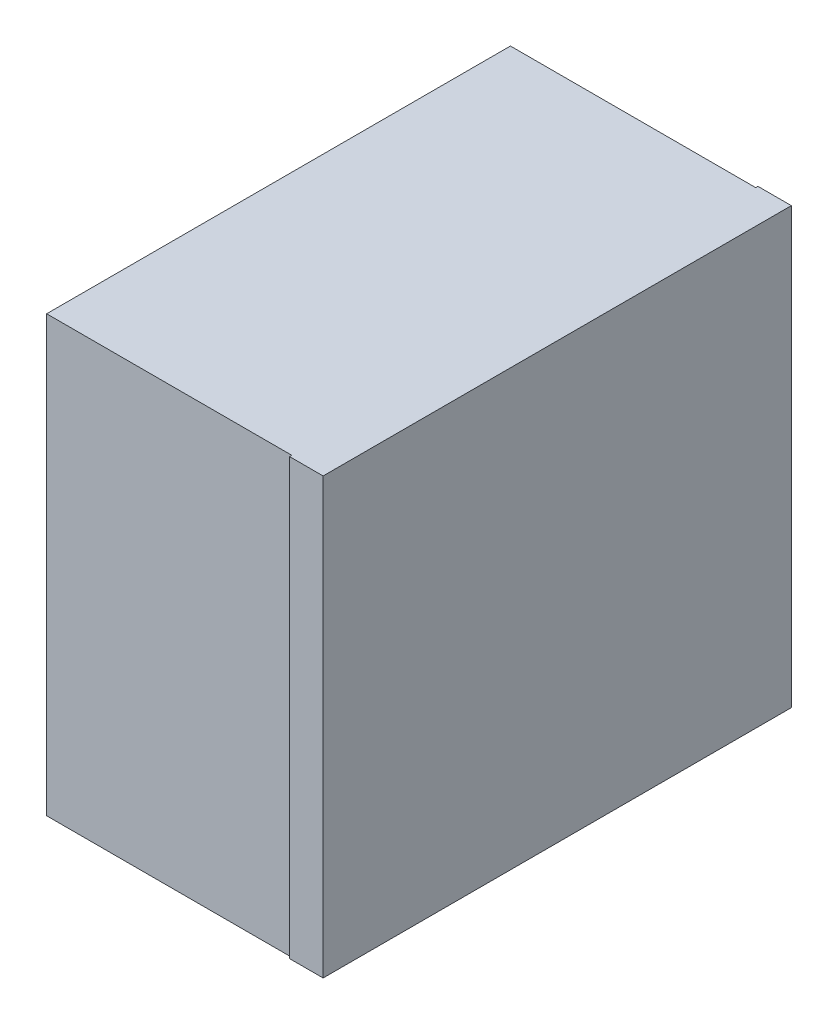
from build123d import *

# Parameters (mm, degrees)
CROQUIS2_W              = 85
CROQUIS2_H              = 85
SALIENTE_EXTRUIR1_DEPTH = 110
CROQUIS3_W              = 20
CROQUIS3_H              = 85
CROQUIS3_W_2            = 7
CORTAR_EXTRUIR1_DEPTH   = 2
CROQUIS5_W              = 83
CROQUIS5_H              = 20
CROQUIS5_H_2            = 7
CORTAR_EXTRUIR2_DEPTH   = 2
CROQUIS6_W              = 20
CROQUIS6_H              = 83
CROQUIS6_W_2            = 7
CORTAR_EXTRUIR3_DEPTH   = 2
CROQUIS7_W              = 81
CROQUIS7_H              = 20
CROQUIS7_H_2            = 7
CORTAR_EXTRUIR4_DEPTH   = 2
CORTAR_EXTRUIR6_DEPTH   = 2
CROQUIS12_W             = 9
CROQUIS12_H             = 9
CORTAR_EXTRUIR7_DEPTH   = 2.5
SALIENTE_EXTRUIR3_DEPTH = 10
SALIENTE_EXTRUIR4_DEPTH = 10
SALIENTE_EXTRUIR5_DEPTH = 10
CROQUIS20_W             = 10
CROQUIS20_H             = 10
SALIENTE_EXTRUIR6_DEPTH = 25
CROQUIS21_W             = 150.699966202
CROQUIS21_H             = 120.747177889
CORTAR_EXTRUIR9_DEPTH   = 112
CROQUIS22_W             = 210
CROQUIS22_H             = 195
SALIENTE_EXTRUIR7_DEPTH = 15
CROQUIS23_W             = 208
CROQUIS23_H             = 195
CROQUIS23_W_2           = 188
CROQUIS23_H_2           = 175
EXTRUIR_L_MINA1_DEPTH   = 110
SALIENTE_EXTRUIR8_REACH = 234.166
CROQUIS25_R             = 15
SALIENTE_EXTRUIR8_DRAFT = -10
CROQUIS26_R             = 5
SALIENTE_EXTRUIR9_DEPTH = 10


with BuildPart() as part:
    # Croquis2 → Saliente-Extruir1 (new body)
    with BuildSketch(Plane.XY):
        Rectangle(CROQUIS2_W, CROQUIS2_H)
    extrude(amount=SALIENTE_EXTRUIR1_DEPTH)

    # Croquis3 → Cortar-Extruir1 (cut)
    with BuildSketch(Plane.ZY.offset(42.5)):
        with Locations((100, 0)):
            Rectangle(CROQUIS3_W, CROQUIS3_H)
        with Locations((81.5, 0)):
            Rectangle(CROQUIS3_W_2, CROQUIS3_H)
        with Locations((69.5, 0)):
            Rectangle(CROQUIS3_W_2, CROQUIS3_H)
    extrude(amount=-CORTAR_EXTRUIR1_DEPTH, mode=Mode.SUBTRACT)

    # Croquis5 → Cortar-Extruir2 (cut)
    with BuildSketch(Plane(origin=(0, 42.5, 0), x_dir=(1, 0, 0), z_dir=(0, 1, 0))):
        with Locations((1, -100)):
            Rectangle(CROQUIS5_W, CROQUIS5_H)
        with Locations((1, -81.5)):
            Rectangle(CROQUIS5_W, CROQUIS5_H_2)
        with Locations((1, -69.5)):
            Rectangle(CROQUIS5_W, CROQUIS5_H_2)
    extrude(amount=-CORTAR_EXTRUIR2_DEPTH, mode=Mode.SUBTRACT)

    # Croquis6 → Cortar-Extruir3 (cut)
    with BuildSketch(Plane(origin=(42.5, 0, 0), x_dir=(0, 0, -1), z_dir=(1, 0, 0))):
        with Locations((-100, -1)):
            Rectangle(CROQUIS6_W, CROQUIS6_H)
        with Locations((-81.5, -1)):
            Rectangle(CROQUIS6_W_2, CROQUIS6_H)
        with Locations((-69.5, -1)):
            Rectangle(CROQUIS6_W_2, CROQUIS6_H)
    extrude(amount=-CORTAR_EXTRUIR3_DEPTH, mode=Mode.SUBTRACT)

    # Croquis7 → Cortar-Extruir4 (cut)
    with BuildSketch(Plane(origin=(0, -42.5, 0), x_dir=(-1, 0, 0), z_dir=(0, -1, 0))):
        with Locations((0, -100)):
            Rectangle(CROQUIS7_W, CROQUIS7_H)
        with Locations((0, -81.5)):
            Rectangle(CROQUIS7_W, CROQUIS7_H_2)
        with Locations((0, -69.5)):
            Rectangle(CROQUIS7_W, CROQUIS7_H_2)
    extrude(amount=-CORTAR_EXTRUIR4_DEPTH, mode=Mode.SUBTRACT)

    # Croquis8 → Cortar-Extruir6 (cut)
    with BuildSketch(Plane(origin=(0, 0, 0), x_dir=(-1, 0, 0), z_dir=(0, 0, -1))):
        Polygon((-19.5, -22.5), (-19.5, -1.5), (-28.5, -1.5), (-28.5, 7.5), (-42.5, 7.5), (-42.5, -22.5), align=None)
        Polygon((42.5, -22.5), (42.5, 7.5), (28.5, 7.5), (28.5, -1.5), (19.5, -1.5), (19.5, -22.5), align=None)
    extrude(amount=-CORTAR_EXTRUIR6_DEPTH, mode=Mode.SUBTRACT)

    # Croquis12 → Cortar-Extruir7 (cut)
    with BuildSketch(Plane(origin=(0, 0, 0), x_dir=(-1, 0, 0), z_dir=(0, 0, -1))):
        with Locations((-24, 3)):
            Rectangle(CROQUIS12_W, CROQUIS12_H)
        with Locations((24, 3)):
            Rectangle(CROQUIS12_W, CROQUIS12_H)
    extrude(amount=-CORTAR_EXTRUIR7_DEPTH, mode=Mode.SUBTRACT)

    # Croquis15 → Saliente-Extruir3 (add)
    with BuildSketch(Plane(origin=(-11, 0, 0), x_dir=(0, 0, -1), z_dir=(1, 0, 0))):
        Polygon((0, 17), (18.5, 17), (18.5, 25.5), (28.5, 25.5), (28.5, 34), (10, 34), (10, 25.5), (0, 25.5), align=None)
    extrude(amount=-SALIENTE_EXTRUIR3_DEPTH)

    # Croquis18 → Saliente-Extruir4 (add)
    with BuildSketch(Plane(origin=(11, 0, 0), x_dir=(0, 0, -1), z_dir=(1, 0, 0))):
        Polygon((18.5, 17), (18.5, 25.5), (28.5, 25.5), (28.5, 34), (10, 34), (10, 25.5), (0, 25.5), (0, 17), align=None)
    extrude(amount=SALIENTE_EXTRUIR4_DEPTH)

    # Croquis19 → Saliente-Extruir5 (add)
    with BuildSketch(Plane(origin=(0, 42.5, 0), x_dir=(1, 0, 0), z_dir=(0, 1, 0))):
        Polygon((60.5, -59.370690979), (49.5, -59.370690979), (49.5, -52.370690979), (42.5, -52.370690979), (42.5, -24.05242538), (49.5, -24.05242538), (49.5, -17.05242538), (60.5, -17.05242538), (60.5, -24.05242538), (71.5, -24.05242538), (71.5, -31.05242538), (82.5, -31.05242538), (82.5, -38.05242538), (89.5, -38.05242538), (89.5, -58.05242538), (82.5, -58.05242538), (82.5, -73.370690979), (71.5, -73.370690979), (71.5, -66.370690979), (60.5, -66.370690979), align=None)
        Polygon((-49.5, -17.05242538), (-60.5, -17.05242538), (-60.5, -24.05242538), (-71.5, -24.05242538), (-71.5, -31.05242538), (-82.5, -31.05242538), (-82.5, -38.05242538), (-89.5, -38.05242538), (-89.5, -58.05242538), (-82.5, -58.05242538), (-82.5, -73.370690979), (-71.5, -73.370690979), (-71.5, -66.370690979), (-60.5, -66.370690979), (-60.5, -59.370690979), (-49.5, -59.370690979), (-49.5, -52.370690979), (-42.5, -52.370690979), (-42.5, -24.05242538), (-49.5, -24.05242538), align=None)
    extrude(amount=-SALIENTE_EXTRUIR5_DEPTH)

    # Croquis20 → Saliente-Extruir6 (add)
    with BuildSketch(Plane(origin=(0, -42.5, 0), x_dir=(-1, 0, 0), z_dir=(0, -1, 0))):
        with Locations((-29.5, -25)):
            Rectangle(CROQUIS20_W, CROQUIS20_H)
        with Locations((29.5, -25)):
            Rectangle(CROQUIS20_W, CROQUIS20_H)
        with Locations((-29.5, -60)):
            Rectangle(CROQUIS20_W, CROQUIS20_H)
        with Locations((29.5, -60)):
            Rectangle(CROQUIS20_W, CROQUIS20_H)
    extrude(amount=SALIENTE_EXTRUIR6_DEPTH)

    # Croquis21 → Cortar-Extruir9 (cut)
    with BuildSketch(Plane(origin=(0, 0, 0), x_dir=(0, 0, -1), z_dir=(1, 0, 0))):
        with Locations((-39.284674443, -15.603112065)):
            Rectangle(CROQUIS21_W, CROQUIS21_H)
    extrude(amount=CORTAR_EXTRUIR9_DEPTH, mode=Mode.SUBTRACT)

    # Croquis22 → Saliente-Extruir7 (add)
    with BuildSketch(Plane(origin=(0, 0, 0), x_dir=(0, 0, -1), z_dir=(1, 0, 0))):
        with Locations((-44, 0)):
            Rectangle(CROQUIS22_W, CROQUIS22_H)
    extrude(amount=SALIENTE_EXTRUIR7_DEPTH)

    # Croquis23 → Extruir-Lámina1 (add)
    with BuildSketch(Plane.ZY):
        with Locations((44, 0)):
            Rectangle(CROQUIS23_W, CROQUIS23_H)
        with Locations((44, 0)):
            Rectangle(CROQUIS23_W_2, CROQUIS23_H_2, mode=Mode.SUBTRACT)
    extrude(amount=EXTRUIR_L_MINA1_DEPTH)




with BuildPart() as saliente_extruir8_long_prism_1:
    # Croquis25 → Saliente-Extruir8 (the long prism of profile 1, to be tilted and cut off)
    with BuildSketch(Plane(origin=(0, 42.5, 0), x_dir=(1, 0, 0), z_dir=(0, 1, 0))):
        with Locations((0, -37)):
            Circle(CROQUIS25_R)
    extrude(amount=SALIENTE_EXTRUIR8_REACH)
    saliente_extruir8_tool1_sides = [saliente_extruir8_long_prism_1.faces().sort_by_distance(p)[0] for p in [
        (-15, 159.583, 37),
    ]]
    draft(saliente_extruir8_tool1_sides, Plane(origin=(0, 42.5, 0), x_dir=(1, 0, 0), z_dir=(0, 1, 0)), SALIENTE_EXTRUIR8_DRAFT)  # the draft: side faces tilted about the start plane


with BuildPart() as part_1:
    add(part.part)
    saliente_extruir8_tool1 = saliente_extruir8_long_prism_1.part - part.part
    add(saliente_extruir8_tool1.solids().sort_by_distance((0, 42.5, 37))[0])

    # Barrer2: sweep along a path in Croquis35
    with BuildLine(Plane(origin=(0, 0, 0), x_dir=(0, 0, -1), z_dir=(1, 0, 0))) as barrer2_path:
        Line((-6, 42.5), (10, 87.5))
    # Croquis26 → Barrer2 (sweep)
    with BuildSketch(Plane(origin=(0, 42.5, 0), x_dir=(1, 0, 0), z_dir=(0, 1, 0))):
        with Locations((0, -6)):
            Circle(CROQUIS26_R)
    sweep(path=barrer2_path.line)

    # Croquis37 → Saliente-Extruir9 (add)
    with BuildSketch(Plane.ZY):
        with BuildLine():
            Line((105, -53.5), (117, -53.5))
            Line((117, -53.5), (117, 55.5))
            Line((117, 55.5), (105, 55.5))
            ThreePointArc((105, 55.5), (97, 63.5), (105, 71.5))
            Line((105, 71.5), (125, 71.5))
            ThreePointArc((125, 71.5), (130.656854249, 69.156854249), (133, 63.5))
            Line((133, 63.5), (133, -61.5))
            ThreePointArc((133, -61.5), (130.656854249, -67.156854249), (125, -69.5))
            Line((125, -69.5), (105, -69.5))
            ThreePointArc((105, -69.5), (97, -61.5), (105, -53.5))
        make_face()
        with BuildLine():
            ThreePointArc((-47, 63.5), (-44.656854249, 69.156854249), (-39, 71.5))
            Line((-39, 71.5), (-19, 71.5))
            ThreePointArc((-19, 71.5), (-11, 63.5), (-19, 55.5))
            Line((-19, 55.5), (-31, 55.5))
            Line((-31, 55.5), (-31, -53.5))
            Line((-31, -53.5), (-19, -53.5))
            ThreePointArc((-19, -53.5), (-11, -61.5), (-19, -69.5))
            Line((-19, -69.5), (-39, -69.5))
            ThreePointArc((-39, -69.5), (-44.656854249, -67.156854249), (-47, -61.5))
            Line((-47, -61.5), (-47, 63.5))
        make_face()
    extrude(amount=SALIENTE_EXTRUIR9_DEPTH)


solid = part_1.part
